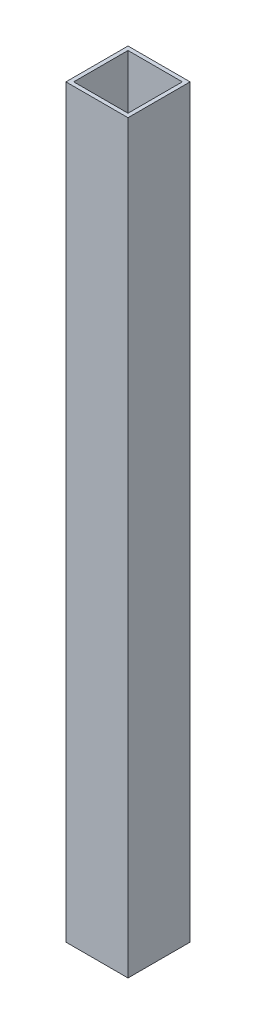
from build123d import *

# Parameters (mm, degrees)
SKETCH1_W           = 50.8
SKETCH1_H           = 50.8
SKETCH1_W_2         = 44.45
SKETCH1_H_2         = 44.45
BOSS_EXTRUDE1_DEPTH = 609.6


with BuildPart() as part:
    # Sketch1 → Boss-Extrude1 (new body)
    with BuildSketch(Plane(origin=(0, 0, 0), x_dir=(1, 0, 0), z_dir=(0, 1, 0))):
        Rectangle(SKETCH1_W, SKETCH1_H)
        Rectangle(SKETCH1_W_2, SKETCH1_H_2, mode=Mode.SUBTRACT)
    extrude(amount=BOSS_EXTRUDE1_DEPTH)


solid = part.part
